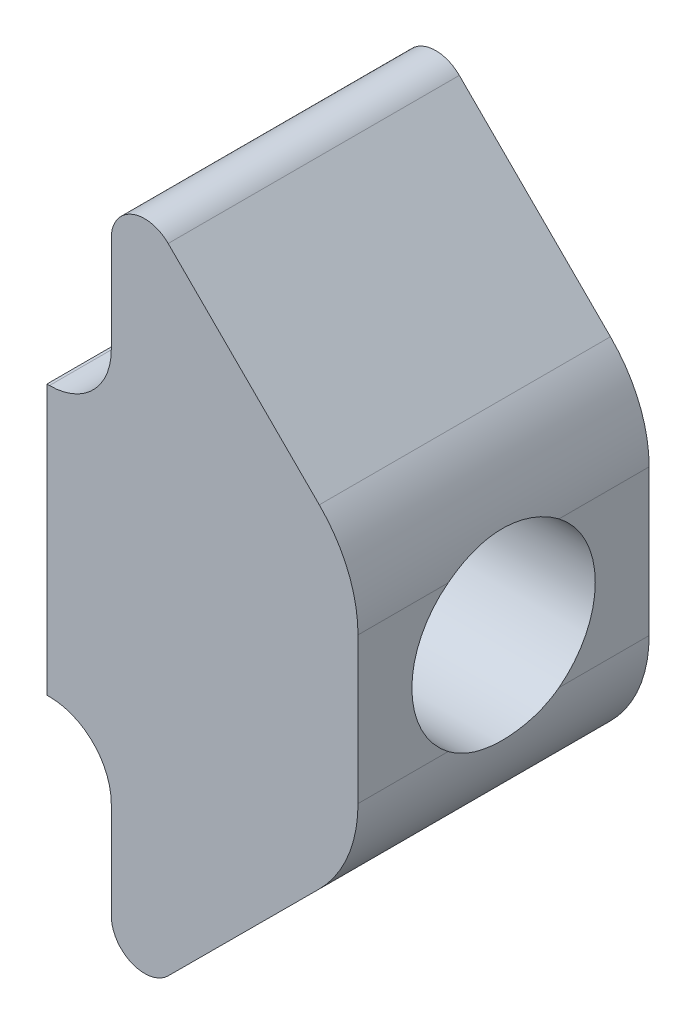
from build123d import *

# Parameters (mm, degrees)
BOSS_EXTRUDE1_DEPTH = 6.35
CUT_EXTRUDE1_REACH  = 13.714
SKETCH2_R           = 2
FILLET1_SIZE        = 0.4


with BuildPart() as part:
    # Sketch1 → Boss-Extrude1 (new body)
    with BuildSketch(Plane.XY):
        with BuildLine():
            Line((-11.5951, -2.938456882), (-11.5951, 2.938456882))
            Line((-11.5951, 2.938456882), (-11.539212407, 2.938456882))
            ThreePointArc((-11.539212407, 2.938456882), (-10.585316586, 3.333573468), (-10.1902, 4.287469289))
            Line((-10.1902, 4.287469289), (-10.1902, 6.402089023))
            ThreePointArc((-10.1902, 6.402089023), (-9.74154152, 7.073969797), (-8.94902056, 6.917034355))
            Line((-8.94902056, 6.917034355), (-5.652895046, 3.628441884))
            ThreePointArc((-5.652895046, 3.628441884), (-5.027976112, 2.694919539), (-4.8085, 1.593185507))
            Line((-4.8085, 1.593185507), (-4.8085, -1.593185507))
            ThreePointArc((-4.8085, -1.593185507), (-5.027976112, -2.694919539), (-5.652895046, -3.628441884))
            Line((-5.652895046, -3.628441884), (-8.94902056, -6.917034355))
            ThreePointArc((-8.94902056, -6.917034355), (-9.74154152, -7.073969797), (-10.1902, -6.402089023))
            Line((-10.1902, -6.402089023), (-10.1902, -4.287469289))
            ThreePointArc((-10.1902, -4.287469289), (-10.585316586, -3.333573468), (-11.539212407, -2.938456882))
            Line((-11.539212407, -2.938456882), (-11.5951, -2.938456882))
        make_face()
    extrude(amount=BOSS_EXTRUDE1_DEPTH)

    # Sketch2 → Cut-Extrude1 (cut, up to next)
    with BuildSketch(Plane.ZY.offset(11.5951), mode=Mode.PRIVATE) as cut_extrude1_sk1:
        with Locations((3.175, 0)):
            Circle(SKETCH2_R)
    cut_extrude1_tool1 = extrude(cut_extrude1_sk1.sketch, amount=-CUT_EXTRUDE1_REACH, mode=Mode.PRIVATE) & part.part
    add(cut_extrude1_tool1.solids().sort_by_distance((-11.5951, 0, 3.175))[0], mode=Mode.SUBTRACT)

    # Fillet1
    fillet1_edges = [part.edges().sort_by_distance(p)[0] for p in [
        (-11.5951, 0, 1.175),
    ]]
    chamfer(fillet1_edges, length=FILLET1_SIZE)


solid = part.part
